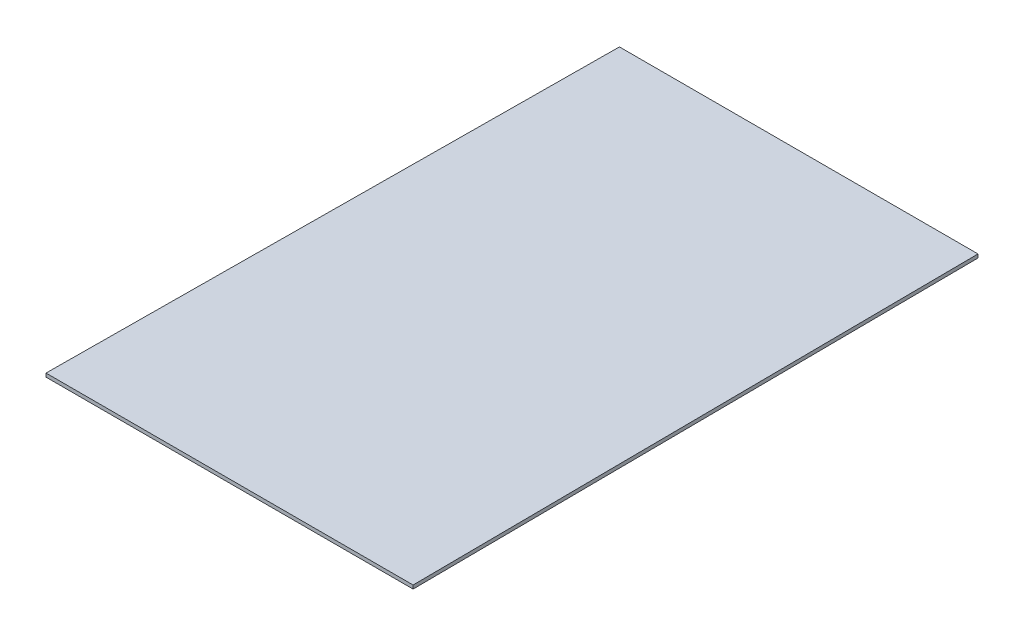
from build123d import *

# Parameters (mm, degrees)
BOSS_EXTRUDE1_DEPTH = 3.175


with BuildPart() as part:
    # Sketch1 → Boss-Extrude1 (new body)
    with BuildSketch(Plane(origin=(0, 0, 0), x_dir=(1, 0, 0), z_dir=(0, 1, 0))):
        Polygon((-163.83, 0), (163.83, 0), (160.02, 508), (-160.02, 508), align=None)
    extrude(amount=BOSS_EXTRUDE1_DEPTH)


solid = part.part
